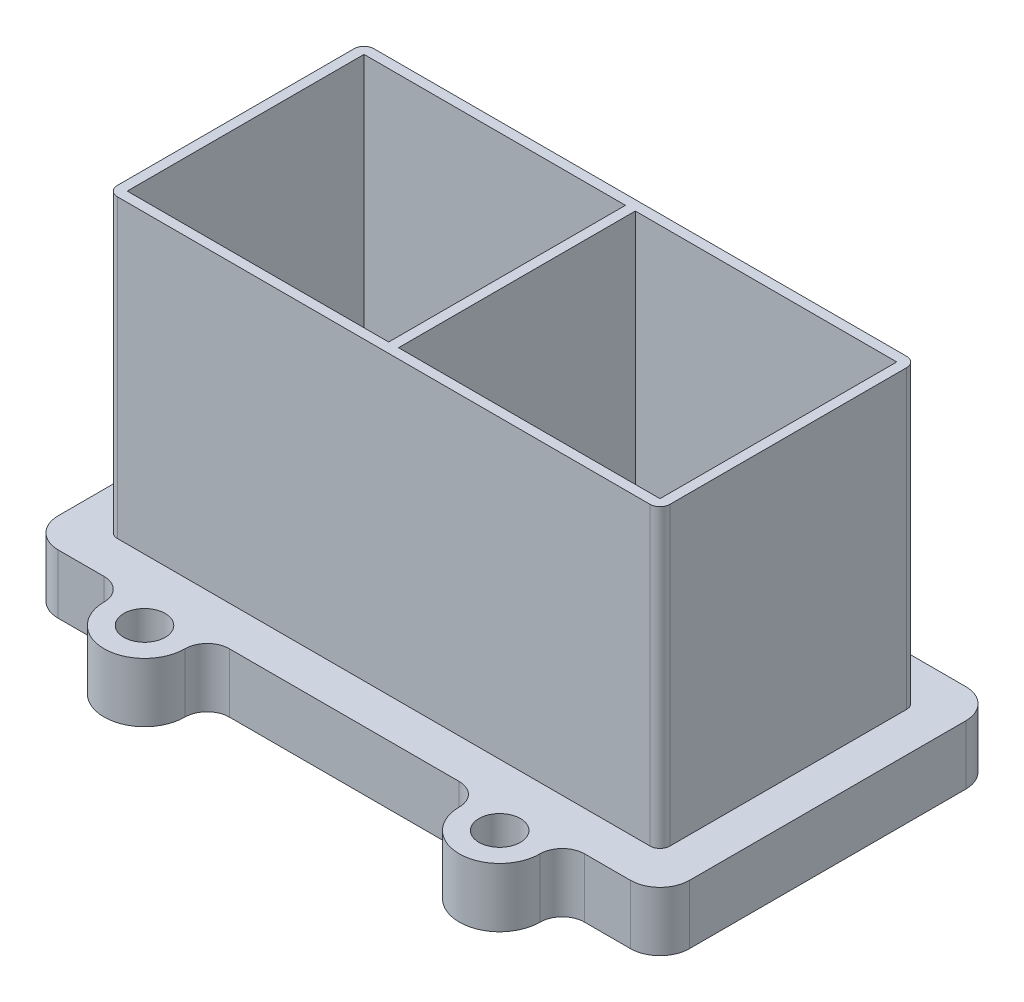
from build123d import *

# Parameters (mm, degrees)
BASE_PLATE_AND_PORTS_2_R   = 0.35
BASE_PLATE_AND_PORTS_2_R_2 = 1.05
BASE_PLATE_AND_PORTS_DEPTH = 1.5
RESERVOIRS_W               = 0.5
RESERVOIRS_H               = 12
BOSS_EXTRUDE1_DEPTH        = 15


with BuildPart() as part:
    # Base-plate and ports 2 → Base plate and ports (new, symmetric)
    with BuildSketch(Plane(origin=(0, 0, 0), x_dir=(1, 0, 0), z_dir=(0, 1, 0))):
        with BuildLine():
            Line((-16, -7), (-16, 7))
            ThreePointArc((-16, 7), (-15.560660172, 8.060660172), (-14.5, 8.5))
            Line((-14.5, 8.5), (-3.175, 8.5))
            ThreePointArc((-3.175, 8.5), (-2.379504871, 8.829504871), (-2.05, 9.625))
            ThreePointArc((-2.05, 9.625), (0, 11.675), (2.05, 9.625))
            ThreePointArc((2.05, 9.625), (2.379504871, 8.829504871), (3.175, 8.5))
            Line((3.175, 8.5), (14.5, 8.5))
            ThreePointArc((14.5, 8.5), (15.560660172, 8.060660172), (16, 7))
            Line((16, 7), (16, -7))
            ThreePointArc((16, -7), (15.560660172, -8.060660172), (14.5, -8.5))
            Line((14.5, -8.5), (12.175, -8.5))
            ThreePointArc((12.175, -8.5), (11.379504871, -8.829504871), (11.05, -9.625))
            ThreePointArc((11.05, -9.625), (9, -11.675), (6.95, -9.625))
            ThreePointArc((6.95, -9.625), (6.620495129, -8.829504871), (5.825, -8.5))
            Line((5.825, -8.5), (-5.825, -8.5))
            ThreePointArc((-5.825, -8.5), (-6.620495129, -8.829504871), (-6.95, -9.625))
            ThreePointArc((-6.95, -9.625), (-9, -11.675), (-11.05, -9.625))
            ThreePointArc((-11.05, -9.625), (-11.379504871, -8.829504871), (-12.175, -8.5))
            Line((-12.175, -8.5), (-14.5, -8.5))
            ThreePointArc((-14.5, -8.5), (-15.560660172, -8.060660172), (-16, -7))
        make_face()
        with Locations(Location((-10.5, 3, 0), (0, 0, 270))):
            Circle(BASE_PLATE_AND_PORTS_2_R, mode=Mode.SUBTRACT)
        with Locations(Location((10.5, 3, 0), (0, 0, 270))):
            Circle(BASE_PLATE_AND_PORTS_2_R, mode=Mode.SUBTRACT)
        with Locations(Location((10.5, -3, 0), (0, 0, 270))):
            Circle(BASE_PLATE_AND_PORTS_2_R, mode=Mode.SUBTRACT)
        with Locations(Location((-10.5, -3, 0), (0, 0, 270))):
            Circle(BASE_PLATE_AND_PORTS_2_R, mode=Mode.SUBTRACT)
        with Locations(Location((0, 9.625, 0), (0, 0, 270))):
            Circle(BASE_PLATE_AND_PORTS_2_R_2, mode=Mode.SUBTRACT)
        with Locations(Location((-9, -9.625, 0), (0, 0, 270))):
            Circle(BASE_PLATE_AND_PORTS_2_R_2, mode=Mode.SUBTRACT)
        with Locations(Location((9, -9.625, 0), (0, 0, 270))):
            Circle(BASE_PLATE_AND_PORTS_2_R_2, mode=Mode.SUBTRACT)
    extrude(amount=BASE_PLATE_AND_PORTS_DEPTH, both=True)

    # Reservoirs → Boss-Extrude1 (add)
    # profile 1 of 2: a face of its own
    with BuildSketch(Plane(origin=(0, 1.5, 0), x_dir=(1, 0, 0), z_dir=(0, 1, 0))):
        with BuildLine():
            Line((-13.5, 6.5), (13.5, 6.5))
            ThreePointArc((13.5, 6.5), (13.853553391, 6.353553391), (14, 6))
            Line((14, 6), (14, -6))
            ThreePointArc((14, -6), (13.853553391, -6.353553391), (13.5, -6.5))
            Line((13.5, -6.5), (-13.5, -6.5))
            ThreePointArc((-13.5, -6.5), (-13.853553391, -6.353553391), (-14, -6))
            Line((-14, -6), (-14, 6))
            ThreePointArc((-14, 6), (-13.853553391, 6.353553391), (-13.5, 6.5))
        make_face()
        Polygon((4.333333333, -6), (4.833333333, -6), (13.5, -6), (13.5, 6), (4.833333333, 6), (4.333333333, 6), (-4.333333333, 6), (-4.833333333, 6), (-13.5, 6), (-13.5, -6), (-4.833333333, -6), (-4.333333333, -6), align=None, mode=Mode.SUBTRACT)
    # profile 2 of 2: a face of its own
    with BuildSketch(Plane(origin=(0, 1.5, 0), x_dir=(1, 0, 0), z_dir=(0, 1, 0))):
        Rectangle(RESERVOIRS_W, RESERVOIRS_H)
    extrude(amount=BOSS_EXTRUDE1_DEPTH)


solid = part.part
